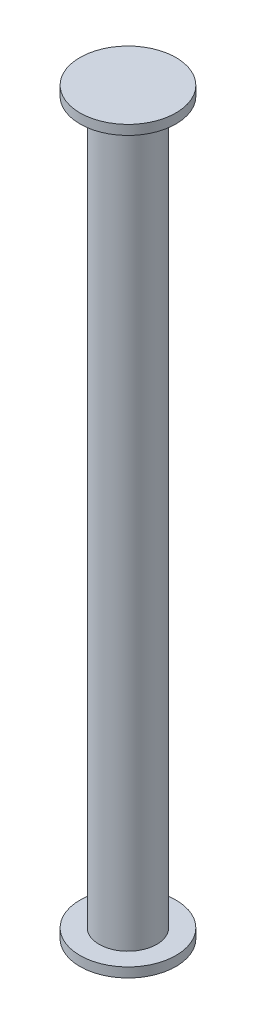
from build123d import *

# Parameters (mm, degrees)
SKETCH3_R           = 0.5
BOSS_EXTRUDE1_DEPTH = 0.1
SKETCH4_R           = 0.3
BOSS_EXTRUDE2_DEPTH = 7.5
SKETCH5_R           = 0.5
BOSS_EXTRUDE3_DEPTH = 0.1


with BuildPart() as part:
    # Sketch3 → Boss-Extrude1 (new body)
    with BuildSketch(Plane(origin=(0, 0, 0), x_dir=(1, 0, 0), z_dir=(0, 1, 0))):
        with Locations(Location((0, 0, 0), (0, 0, 270))):
            Circle(SKETCH3_R)
    extrude(amount=BOSS_EXTRUDE1_DEPTH)

    # Sketch4 → Boss-Extrude2 (add)
    with BuildSketch(Plane(origin=(0, 0.1, 0), x_dir=(1, 0, 0), z_dir=(0, 1, 0))):
        with Locations(Location((0, 0, 0), (0, 0, 270))):
            Circle(SKETCH4_R)
    extrude(amount=BOSS_EXTRUDE2_DEPTH)

    # Sketch5 → Boss-Extrude3 (add)
    with BuildSketch(Plane(origin=(0, 7.6, 0), x_dir=(1, 0, 0), z_dir=(0, 1, 0))):
        with Locations(Location((0, 0, 0), (0, 0, 270))):
            Circle(SKETCH5_R)
    extrude(amount=BOSS_EXTRUDE3_DEPTH)


solid = part.part
